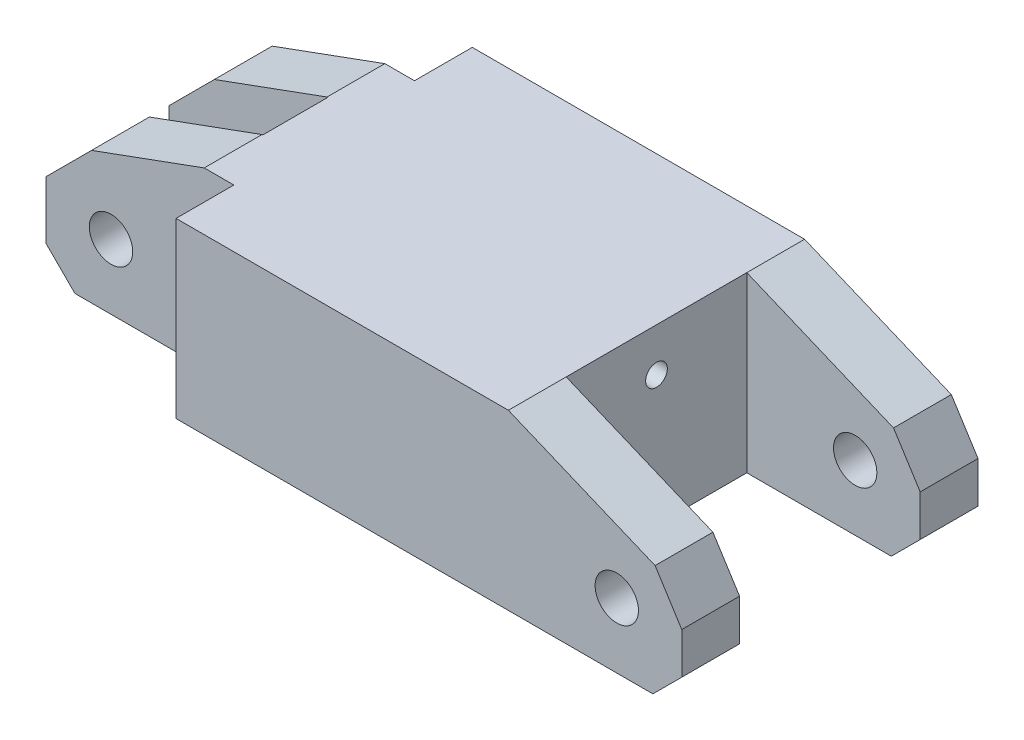
from build123d import *
from OCP.BRepFilletAPI import BRepFilletAPI_MakeChamfer

# Parameters (mm, degrees)
SKETCH_2_W            = 20.5
SKETCH_2_H            = 12
EXTRUDE_1_DEPTH       = 48
SKETCH_3_W            = 22
SKETCH_3_H            = 4.5
CUT_EXTRUDE_1_DEPTH   = 51.527838861
SKETCH_5_W            = 12
SKETCH_5_H            = 12.5
CUT_EXTRUDE_2_DEPTH   = 51.527838861
SKETCH_7_R            = 0.75
CUT_EXTRUDE_3_DEPTH   = 38.908607202
SKETCH_10_W           = 19.106520138
SKETCH_10_H           = 8.950699496
CUT_EXTRUDE_3_2_DEPTH = 51.527838861
SKETCH_11_R           = 1.5
CUT_EXTRUDE_6_DEPTH   = 52.110175112
SKETCH_9_R            = 1.5
CUT_EXTRUDE_5_DEPTH   = 53.538081427
SKETCH_12_R           = 0.75
CUT_EXTRUDE_4_DEPTH   = 12
CUT_EXTRUDE_7_DEPTH   = 53.538081427
CHAMFER_5_SIZE        = 2
CHAMFER_5_SIZE2       = 3.354740363
CHAMFER_6_SIZE        = 2
CHAMFER_6_SIZE2       = 2.1420728
SKETCH_14_R           = 0.75
CUT_EXTRUDE_5_2_DEPTH = 5
CUT_EXTRUDE_8_DEPTH   = 10


with BuildPart() as part:
    # Эскиз2 → Вытянуть1 (new body)
    with BuildSketch(Plane(origin=(0, 0, 0), x_dir=(0, 0, -1), z_dir=(1, 0, 0))):
        Rectangle(SKETCH_2_W, SKETCH_2_H)
    extrude(amount=EXTRUDE_1_DEPTH)

    # Эскиз3 → Вырез-Вытянуть1 (cut, through all)
    with BuildSketch(Plane(origin=(0, 6, 0), x_dir=(1, 0, 0), z_dir=(0, 1, 0))):
        Rectangle(SKETCH_3_W, SKETCH_3_H)
    extrude(amount=-CUT_EXTRUDE_1_DEPTH, mode=Mode.SUBTRACT)

    # Эскиз5 → Вырез-Вытянуть2 (cut, through all)
    with BuildSketch(Plane(origin=(0, 6, 0), x_dir=(1, 0, 0), z_dir=(0, 1, 0))):
        with Locations((42, 0)):
            Rectangle(SKETCH_5_W, SKETCH_5_H)
    extrude(amount=-CUT_EXTRUDE_2_DEPTH, mode=Mode.SUBTRACT)

    # Эскиз7 → Cut-Extrude 3 (cut, through all)
    with BuildSketch(Plane(origin=(36, 0, 0), x_dir=(0, 0, -1), z_dir=(1, 0, 0))):
        with Locations((0, 3)):
            Circle(SKETCH_7_R)
    extrude(amount=-CUT_EXTRUDE_3_DEPTH, mode=Mode.SUBTRACT)

    # Эскиз10 → Cut-Extrude 3 2 (cut, through all)
    with BuildSketch(Plane(origin=(0, 6, 0), x_dir=(1, 0, 0), z_dir=(0, 1, 0))):
        with Locations((3.446739931, 10.725349748)):
            Rectangle(SKETCH_10_W, SKETCH_10_H)
        with Locations((3.446739931, -10.725349748)):
            Rectangle(SKETCH_10_W, SKETCH_10_H)
    extrude(amount=-CUT_EXTRUDE_3_2_DEPTH, mode=Mode.SUBTRACT)

    # Эскиз11 → Вытянуть6 (cut, through all)
    with BuildSketch(Plane.XY.offset(6.25)):
        with Locations((4.5, -1.5)):
            Circle(SKETCH_11_R)
    extrude(amount=-CUT_EXTRUDE_6_DEPTH, mode=Mode.SUBTRACT)

    # Эскиз9 → Cut-Extrude 5 (cut, through all)
    with BuildSketch(Plane.XY.offset(10.25)):
        with Locations((43.5, -1.5)):
            Circle(SKETCH_9_R)
    extrude(amount=-CUT_EXTRUDE_5_DEPTH, mode=Mode.SUBTRACT)

    # Эскиз12 → Вырез-Вытянуть4 (cut)
    with BuildSketch(Plane.ZY.offset(-11)):
        with Locations((-1.791386219, -3.407348241)):
            Circle(SKETCH_12_R)
    extrude(amount=-CUT_EXTRUDE_4_DEPTH, mode=Mode.SUBTRACT)

    # Эскиз13 → Вытянуть7 (cut, through all)
    with BuildSketch(Plane.XY.offset(10.25)):
        Polygon((10.95, 6), (0, 6), (0, 2), align=None)
        Polygon((48, 6), (48, 1), (36, 6), align=None)
    extrude(amount=-CUT_EXTRUDE_7_DEPTH, mode=Mode.SUBTRACT)

    # Фаска5: one chamfer whose edges measure the first distance from different faces: ONE call of the kernel's chamfer builder (chamfer() names one face for all edges)
    chamfer_5_edges_1 = [part.edges().sort_by_distance(p)[0] for p in [
        (0, -6, 4.25),
        (0, -6, -4.25),
        (48, -6, -8.25),
        (48, -6, 8.25),
    ]]
    chamfer_5_edges_2 = [part.edges().sort_by_distance(p)[0] for p in [
        (0, 2, 4.25),
    ]]
    chamfer_5_side_2 = [part.faces().sort_by_distance(p)[0] for p in [
        (0, -2, 4.25),
    ]]
    chamfer_5_edges_3 = [part.edges().sort_by_distance(p)[0] for p in [
        (0, 2, -4.25),
    ]]
    chamfer_5_side_3 = [part.faces().sort_by_distance(p)[0] for p in [
        (0, -2, -4.25),
    ]]
    chamfer_5 = BRepFilletAPI_MakeChamfer(part.part.solid().wrapped)
    for e in chamfer_5_edges_1:
        chamfer_5.Add(CHAMFER_5_SIZE, e.wrapped)
    for e in chamfer_5_edges_2:
        chamfer_5.Add(CHAMFER_5_SIZE, CHAMFER_5_SIZE2, e.wrapped, chamfer_5_side_2[0].wrapped)  # the first distance lies on this face
    for e in chamfer_5_edges_3:
        chamfer_5.Add(CHAMFER_5_SIZE, CHAMFER_5_SIZE2, e.wrapped, chamfer_5_side_3[0].wrapped)  # the first distance lies on this face
    add(Compound.cast(chamfer_5.Shape()), mode=Mode.REPLACE)

    # Фаска6: one chamfer whose edges measure the first distance from different faces: ONE call of the kernel's chamfer builder (chamfer() names one face for all edges)
    chamfer_6_edges_1 = [part.edges().sort_by_distance(p)[0] for p in [
        (48, 1, -8.25),
    ]]
    chamfer_6_side_1 = [part.faces().sort_by_distance(p)[0] for p in [
        (42, 3.5, -8.25),
    ]]
    chamfer_6_edges_2 = [part.edges().sort_by_distance(p)[0] for p in [
        (48, 1, 8.25),
    ]]
    chamfer_6_side_2 = [part.faces().sort_by_distance(p)[0] for p in [
        (42, 3.5, 8.25),
    ]]
    chamfer_6 = BRepFilletAPI_MakeChamfer(part.part.solid().wrapped)
    for e in chamfer_6_edges_1:
        chamfer_6.Add(CHAMFER_6_SIZE, CHAMFER_6_SIZE2, e.wrapped, chamfer_6_side_1[0].wrapped)  # the first distance lies on this face
    for e in chamfer_6_edges_2:
        chamfer_6.Add(CHAMFER_6_SIZE, CHAMFER_6_SIZE2, e.wrapped, chamfer_6_side_2[0].wrapped)  # the first distance lies on this face
    add(Compound.cast(chamfer_6.Shape()), mode=Mode.REPLACE)

    # Эскиз14 → Cut-Extrude 5 2 (cut)
    with BuildSketch(Plane(origin=(36, 0, 0), x_dir=(0, 0, -1), z_dir=(1, 0, 0))):
        with Locations((-1.767861063, -3.867641423)):
            Circle(SKETCH_14_R)
    extrude(amount=-CUT_EXTRUDE_5_2_DEPTH, mode=Mode.SUBTRACT)

    # Эскиз15 → Вытянуть8 (cut)
    with BuildSketch(Plane.XZ.offset(6)):
        with BuildLine():
            Line((18, 6.25), (31, 6.25))
            ThreePointArc((31, 6.25), (32.414213562, 5.664213562), (33, 4.25))
            Line((33, 4.25), (33, -4.25))
            ThreePointArc((33, -4.25), (32.414213562, -5.664213562), (31, -6.25))
            Line((31, -6.25), (18, -6.25))
            ThreePointArc((18, -6.25), (16.585786438, -5.664213562), (16, -4.25))
            Line((16, -4.25), (16, 4.25))
            ThreePointArc((16, 4.25), (16.585786438, 5.664213562), (18, 6.25))
        make_face()
    extrude(amount=-CUT_EXTRUDE_8_DEPTH, mode=Mode.SUBTRACT)


solid = part.part
